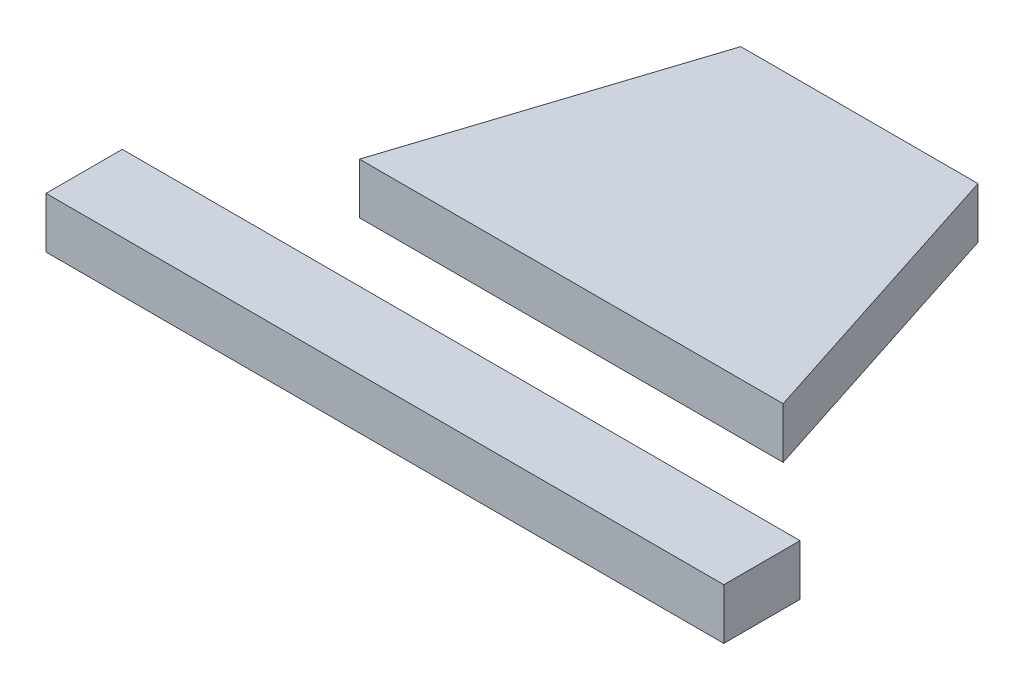
from build123d import *

# Parameters (mm, degrees)
SKETCH1_W             = 40
SKETCH1_H             = 4.5
BOSS_EXTRUDE1_DEPTH   = 3
BOSS_EXTRUDE1_2_DEPTH = 3


with BuildPart() as part:
    # Sketch1 → Boss-Extrude1 (new body)
    with BuildSketch(Plane(origin=(0, 0, 0), x_dir=(1, 0, 0), z_dir=(0, 1, 0))):
        Rectangle(SKETCH1_W, SKETCH1_H)
    extrude(amount=BOSS_EXTRUDE1_DEPTH)


with BuildPart() as body_2:
    # Sketch1 → Boss-Extrude1 2 (new body)
    with BuildSketch(Plane(origin=(0, 0, 0), x_dir=(1, 0, 0), z_dir=(0, 1, 0))):
        Polygon((7, 25.75), (12.5, 8.75), (-12.5, 8.75), (-7, 25.75), align=None)
    extrude(amount=BOSS_EXTRUDE1_2_DEPTH)


solid = Compound([part.part, body_2.part])
